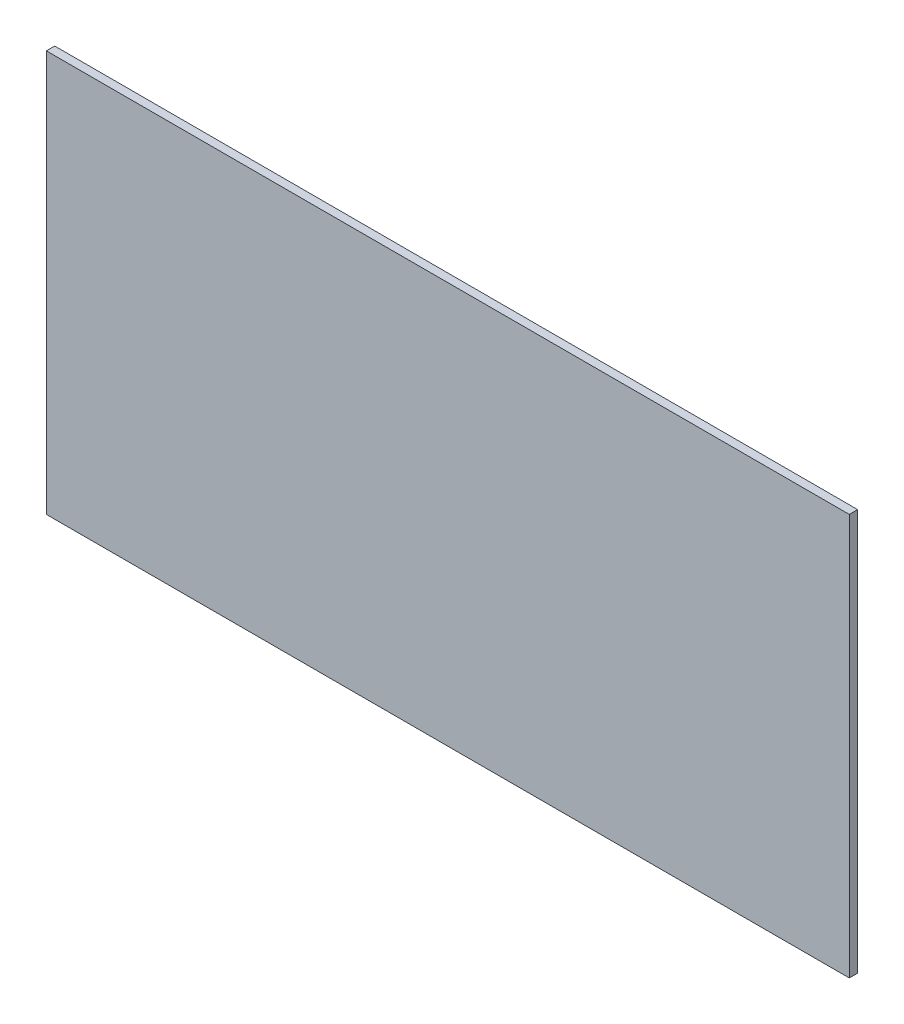
from build123d import *

# Parameters (mm, degrees)
SKETCH2_W           = 609.6
SKETCH2_H           = 304.8
BOSS_EXTRUDE1_DEPTH = 6.35


with BuildPart() as part:
    # Sketch2 → Boss-Extrude1 (new body)
    with BuildSketch(Plane.XY):
        Rectangle(SKETCH2_W, SKETCH2_H)
    extrude(amount=BOSS_EXTRUDE1_DEPTH)


solid = part.part
